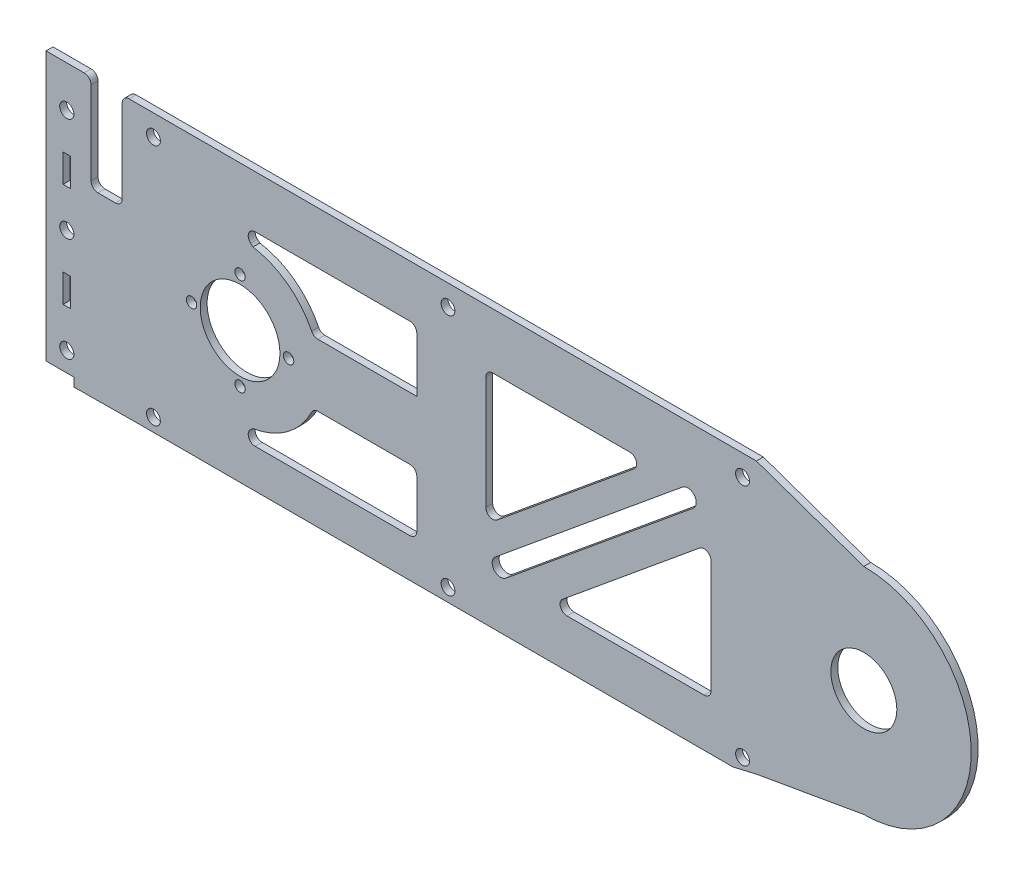
from build123d import *

# Parameters (mm, degrees)
SKETCH_1_R          = 2.05
SKETCH_1_R_2        = 11.5
SKETCH_1_R_3        = 1.5
SKETCH_1_R_4        = 9.525
SKETCH_1_W          = 2.1
SKETCH_1_H          = 8.1
EXTRUDE_1_DEPTH     = 2
SKETCH_2_R          = 2
CUT_EXTRUDE_1_DEPTH = 4
FILLET_1_R          = 2


with BuildPart() as part:
    # 草图1 → 凸台-拉伸1 (new body)
    with BuildSketch(Plane.XY):
        with BuildLine():
            Line((-4.357142857, -0.045714286), (-4.357142857, 41.804285714))
            Line((-4.357142857, 41.804285714), (8.642857143, 41.804285714))
            Line((8.642857143, 41.804285714), (8.642857143, 13.804285714))
            Line((8.642857143, 13.804285714), (17.642857143, 13.804285714))
            Line((17.642857143, 13.804285714), (17.642857143, 41.804285714))
            Line((17.642857143, 41.804285714), (200.642857143, 41.804285714))
            Line((200.642857143, 41.804285714), (231.642857143, 30.954285714))
            ThreePointArc((231.642857143, 30.954285714), (262.642857143, -0.045714286), (231.642857143, -31.045714286))
            Line((231.642857143, -31.045714286), (200.656073527, -36.45591431))
            Line((200.656073527, -36.45591431), (193.846868021, -38.045714286))
            Line((193.846868021, -38.045714286), (22.465844759, -38.045714286))
            Line((22.465844759, -38.045714286), (3.792857143, -38.195714286))
            Line((3.792857143, -38.195714286), (3.792857143, -35.702553436))
            Line((3.792857143, -35.702553436), (-4.357142857, -35.702553436))
            Line((-4.357142857, -35.702553436), (-4.357142857, -0.045714286))
        make_face()
        with Locations((1.642857143, 29.954285714)):
            Circle(SKETCH_1_R, mode=Mode.SUBTRACT)
        with Locations((1.642857143, -0.045714286)):
            Circle(SKETCH_1_R, mode=Mode.SUBTRACT)
        with Locations((1.642857143, -30.045714286)):
            Circle(SKETCH_1_R, mode=Mode.SUBTRACT)
        with Locations((51.642857143, -0.045714286)):
            Circle(SKETCH_1_R_2, mode=Mode.SUBTRACT)
        with Locations((51.642857143, -14.045714286)):
            Circle(SKETCH_1_R_3, mode=Mode.SUBTRACT)
        with Locations((37.642857143, -0.045714286)):
            Circle(SKETCH_1_R_3, mode=Mode.SUBTRACT)
        with Locations((51.642857143, 13.954285714)):
            Circle(SKETCH_1_R_3, mode=Mode.SUBTRACT)
        with Locations((65.642857143, -0.045714286)):
            Circle(SKETCH_1_R_3, mode=Mode.SUBTRACT)
        with Locations((231.642857143, -0.045714286)):
            Circle(SKETCH_1_R_4, mode=Mode.SUBTRACT)
        with Locations((1.642857143, 14.954285714)):
            Rectangle(SKETCH_1_W, SKETCH_1_H, mode=Mode.SUBTRACT)
        with Locations((1.642857143, -15.045714286)):
            Rectangle(SKETCH_1_W, SKETCH_1_H, mode=Mode.SUBTRACT)
    extrude(amount=EXTRUDE_1_DEPTH)

    # 草图2 → 切除-拉伸1 (cut)
    with BuildSketch(Plane.XY.offset(2)):
        with Locations((26.642857143, 35.754285714)):
            Circle(SKETCH_2_R)
        with Locations((111.642857143, 35.754285714)):
            Circle(SKETCH_2_R)
        with Locations((196.642857143, 35.754285714)):
            Circle(SKETCH_2_R)
        with Locations((111.642857143, -34.245714286)):
            Circle(SKETCH_2_R)
        with Locations((196.642857143, -34.245714286)):
            Circle(SKETCH_2_R)
        with Locations((26.642857143, -34.245714286)):
            Circle(SKETCH_2_R)
        Polygon((187.542857143, -24.245714286), (140.41622539, -24.245714286), (187.542857143, 14.56445304), align=None)
        Polygon((122.542857143, 25.754285714), (169.669488896, 25.754285714), (122.542857143, -13.055881612), align=None)
        with BuildLine():
            Line((72.808867631, 8.954285714), (102.642857143, 8.954285714))
            Line((102.642857143, 8.954285714), (102.642857143, 26.754285714))
            Line((102.642857143, 26.754285714), (50.657939371, 26.754285714))
            Line((50.657939371, 26.754285714), (55.363054959, 22.651424922))
            ThreePointArc((55.363054959, 22.651424922), (65.846157695, 18.044787461), (72.808867631, 8.954285714))
        make_face()
        with BuildLine():
            Line((102.642857143, -9.045714286), (102.642857143, -26.845714286))
            Line((102.642857143, -26.845714286), (50.657939371, -26.845714286))
            Line((50.657939371, -26.845714286), (55.363054959, -22.742853493))
            ThreePointArc((55.363054959, -22.742853493), (65.846157695, -18.136216032), (72.808867631, -9.045714286))
            Line((72.808867631, -9.045714286), (102.642857143, -9.045714286))
        make_face()
        with BuildLine():
            Line((125.279005787, -19.870759717), (179.314122281, 24.628747983))
            ThreePointArc((179.314122281, 24.628747983), (182.731673921, 24.298017179), (182.400943117, 20.880465538))
            Line((182.400943117, 20.880465538), (128.365826624, -23.619042162))
            ThreePointArc((128.365826624, -23.619042162), (124.948274984, -23.288311358), (125.279005787, -19.870759717))
        make_face()
    extrude(amount=-CUT_EXTRUDE_1_DEPTH, mode=Mode.SUBTRACT)

    # 圆角1
    fillet_1_edges = [part.edges().sort_by_distance(p)[0] for p in [
        (72.808867631, 8.954285714, 1),
        (50.657939371, 26.754285714, 1),
        (102.642857143, 26.754285714, 1),
        (122.542857143, -13.055881612, 1),
        (122.542857143, 25.754285714, 1),
        (169.669488896, 25.754285714, 1),
        (187.542857143, 14.56445304, 1),
        (187.542857143, -24.245714286, 1),
        (140.41622539, -24.245714286, 1),
        (102.642857143, -26.845714286, 1),
        (50.657939371, -26.845714286, 1),
        (72.808867631, -9.045714286, 1),
        (102.642857143, -9.045714286, 1),
        (8.642857143, 41.804285714, 1),
        (8.642857143, 13.804285714, 1),
        (17.642857143, 13.804285714, 1),
        (17.642857143, 41.804285714, 1),
    ]]
    fillet(fillet_1_edges, radius=FILLET_1_R)


solid = part.part
